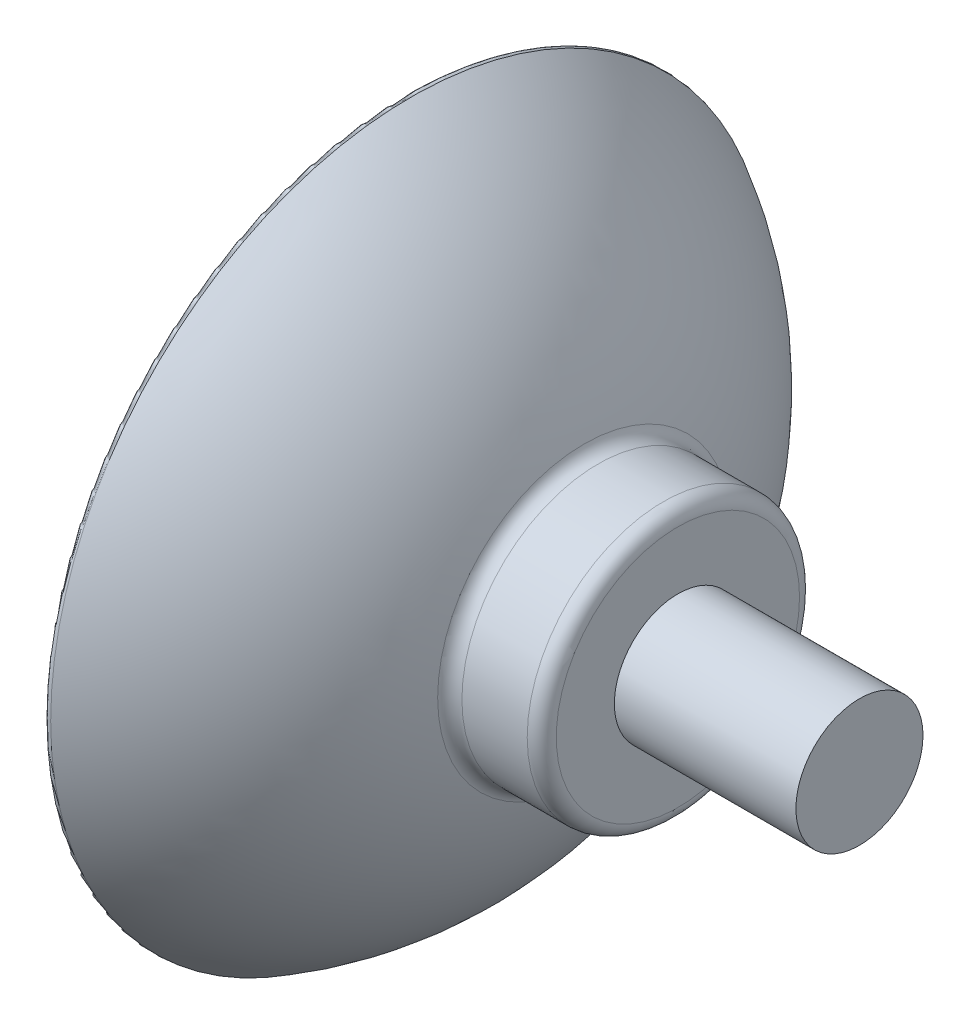
from build123d import *

# Parameters (mm, degrees)
SKETCH2_R           = 2.4
CUT_EXTRUDE1_DEPTH  = 1
FILLET2_R           = 0.8
FILLET3_R           = 0.2
SKETCH7_R           = 3.5
BOSS_EXTRUDE1_DEPTH = 10


with BuildPart() as part:
    # Sketch1 → Revolve2 (revolve)
    with BuildSketch(Plane.XY, mode=Mode.PRIVATE) as revolve2_sk:
        with BuildLine():
            ThreePointArc((-10, 19.5), (-2.660920394, 11.548999567), (0, 1.060911085))
            Line((0, 1.060911085), (0, 7.5))
            ThreePointArc((0, 7.5), (-3.694854211, 14.794116631), (-10, 20))
            Line((-10, 20), (-10, 19.5))
        make_face()
        Polygon((0, 1.060911085), (0, 0), (2, 0), (2, 4.75), (4, 4.75), (4, 0), (5, 0), (5, 7.5), (0, 7.5), align=None)
    revolve(revolve2_sk.sketch.rotate(Axis((0, 0, 0), (-1, 0, 0)), 90), axis=Axis((0, 0, 0), (-1, 0, 0)))

    # Sketch2 → Cut-Extrude1 (cut)
    with BuildSketch(Plane(origin=(5, 0, 0), x_dir=(0, 0, -1), z_dir=(1, 0, 0))):
        Circle(SKETCH2_R)
    extrude(amount=-CUT_EXTRUDE1_DEPTH, mode=Mode.SUBTRACT)

    # Fillet2
    fillet2_edges = [part.edges().sort_by_distance(p)[0] for p in [
        (0, 0, 7.5),
        (5, 0, 7.5),
        (5, 0, 2.4),
    ]]
    fillet(fillet2_edges, radius=FILLET2_R)

    # Fillet3
    fillet3_edges = [part.edges().sort_by_distance(p)[0] for p in [
        (-10, 0, 20),
        (-10, 0, 19.5),
    ]]
    fillet(fillet3_edges, radius=FILLET3_R)

    # Sketch7 → Boss-Extrude1 (add)
    with BuildSketch(Plane(origin=(5, 0, 0), x_dir=(0, 0, -1), z_dir=(1, 0, 0))):
        Circle(SKETCH7_R)
    extrude(amount=BOSS_EXTRUDE1_DEPTH)


solid = part.part
